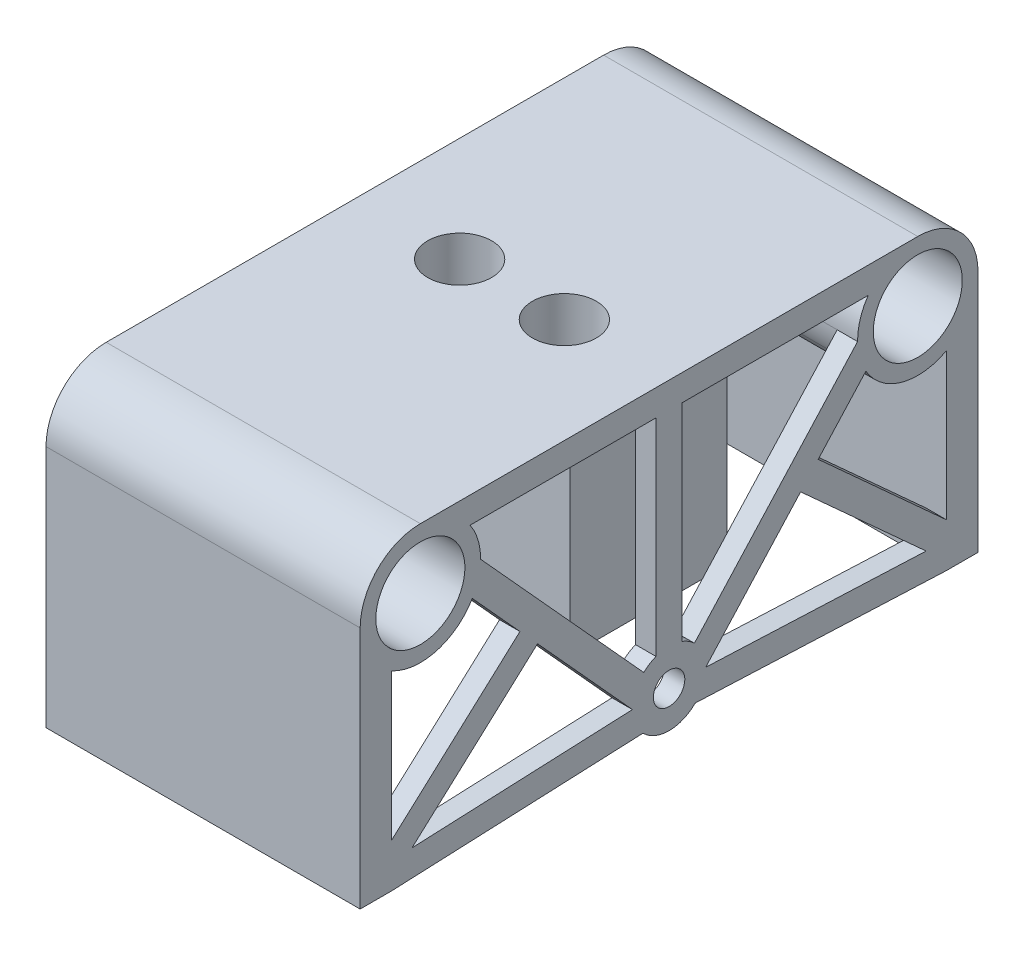
from build123d import *

# Parameters (mm, degrees)
SKETCH4_W           = 60
SKETCH4_H           = 58
BOSS_EXTRUDE2_DEPTH = 59
SKETCH6_R           = 8.500009
SKETCH6_R_2         = 3
SKETCH6_R_3         = 8.5
CUT_EXTRUDE2_DEPTH  = 90.005618
BOSS_EXTRUDE3_START = -30
BOSS_EXTRUDE3_DEPTH = 26.1
CUT_EXTRUDE7_DEPTH  = 52.2
SKETCH9_R           = 6.1
CUT_EXTRUDE8_DEPTH  = 89.005682


with BuildPart() as part:
    # Sketch4 → Boss-Extrude2 (new, symmetric)
    with BuildSketch(Plane.XY):
        Rectangle(SKETCH4_W, SKETCH4_H)
    extrude(amount=BOSS_EXTRUDE2_DEPTH, both=True)

    # Sketch6 → Cut-Extrude2 (cut, through all)
    with BuildSketch(Plane.ZY.offset(30)):
        with BuildLine():
            ThreePointArc((-38.013169, 24), (-36.495651, 20.839801), (-36.000743, 17.369241))
            Line((-36.000743, 17.369241), (-4.839233, -16.942149))
            ThreePointArc((-4.839233, -16.942149), (-3.743539, -16.08511), (-2.500009, -15.461657))
            Line((-2.500009, -15.461657), (-2.500009, 24))
            Line((-2.500009, 24), (-38.013169, 24))
        make_face()
        with BuildLine():
            Line((-28.479809, 1.651024), (-37.584065, 11.67556))
            ThreePointArc((-37.584065, 11.67556), (-44.426868, 6.418217), (-53.000009, 7.40049))
            Line((-53.000009, 7.40049), (-53.000009, -20.618154))
            Line((-53.000009, -20.618154), (-28.479809, 1.651024))
        make_face()
        Polygon((-7.000009, -22.000005), (-25.118256, -2.050322), (-49.094983, -23.825919), align=None)
        with BuildLine():
            ThreePointArc((4.9821, -26.917179), (-9e-06, -29.000005), (-4.982118, -26.917179))
            Line((-4.982118, -26.917179), (-53.000009, -29.000005))
            Line((-53.000009, -29.000005), (-53.000009, -39.703251))
            Line((-53.000009, -39.703251), (52.999991, -37.936887))
            Line((52.999991, -37.936887), (52.999991, -29.000005))
            Line((52.999991, -29.000005), (4.9821, -26.917179))
        make_face()
        with BuildLine():
            ThreePointArc((37.027265, 22.251018), (37.481967, 23.147065), (38.013151, 24))
            Line((38.013151, 24), (2.499991, 24))
            Line((2.499991, 24), (2.499991, -15.461657))
            ThreePointArc((2.499991, -15.461657), (3.743521, -16.08511), (4.839215, -16.942149))
            Line((4.839215, -16.942149), (36.000725, 17.369241))
            ThreePointArc((36.000725, 17.369241), (36.246101, 19.866462), (37.027265, 22.251018))
        make_face()
        Polygon((6.999991, -22.000005), (49.094964, -23.825919), (25.118238, -2.050322), align=None)
        with BuildLine():
            Line((37.584046, 11.67556), (28.479791, 1.651024))
            Line((28.479791, 1.651024), (52.999991, -20.618154))
            Line((52.999991, -20.618154), (52.999991, 7.40049))
            ThreePointArc((52.999991, 7.40049), (52.30182, 7.050477), (51.581504, 6.748658))
            ThreePointArc((51.581504, 6.748658), (43.681779, 6.652356), (37.584046, 11.67556))
        make_face()
        with BuildLine():
            ThreePointArc((-59.000009, 17.5), (-55.631734, 25.631734), (-47.5, 29.000009))
            Line((-47.5, 29.000009), (-47.5, 35.726664))
            Line((-47.5, 35.726664), (-66.854255, 35.726664))
            Line((-66.854255, 35.726664), (-66.147279, 17.5))
            Line((-66.147279, 17.5), (-59.000009, 17.5))
        make_face()
        with BuildLine():
            Line((47.076133, 34.936715), (47.499986, 29))
            ThreePointArc((47.499986, 29), (55.631716, 25.631727), (58.999989, 17.499996))
            Line((58.999989, 17.499996), (67.171398, 17.499996))
            Line((67.171398, 17.499996), (67.171398, 34.57466))
            Line((67.171398, 34.57466), (47.076133, 34.936715))
        make_face()
        with Locations((-47.5, 17.5)):
            Circle(SKETCH6_R)
        with Locations((-9e-06, -22.000005)):
            Circle(SKETCH6_R_2)
        with Locations((47.499991, 17.499994)):
            Circle(SKETCH6_R_3)
    extrude(amount=-CUT_EXTRUDE2_DEPTH, mode=Mode.SUBTRACT)

    # Sketch7 → Boss-Extrude3 (add, symmetric)
    with BuildSketch(Plane.ZY.offset(30).offset(BOSS_EXTRUDE3_START)):
        Polygon((-15, 24), (-15, -11), (15.389045, -11), (15, 24), align=None)
    extrude(amount=BOSS_EXTRUDE3_DEPTH, both=True)

    # Sketch8 → Cut-Extrude7 (cut)
    with BuildSketch(Plane.ZY.offset(26.1)):
        with BuildLine():
            Line((-15, 24), (-38.013169, 24))
            ThreePointArc((-38.013169, 24), (-38.964218, 9.793476), (-53.000009, 7.40049))
            Line((-53.000009, 7.40049), (-53.000009, -24.011121))
            Line((-53.000009, -24.011121), (-53.000009, -39.458207))
            Line((-53.000009, -39.458207), (52.999999, -37.612059))
            Line((52.999999, -37.612059), (52.999999, -24.011121))
            Line((52.999999, -24.011121), (52.999999, 7.40049))
            ThreePointArc((52.999999, 7.40049), (38.964206, 9.793474), (38.013158, 24))
            Line((38.013158, 24), (14.99999, 24))
            Line((14.99999, 24), (14.99999, -11))
            Line((14.99999, -11), (-14.201079, -11))
            Line((-14.201079, -11), (-15, -11))
            Line((-15, -11), (-15, 24))
        make_face()
    extrude(amount=-CUT_EXTRUDE7_DEPTH, mode=Mode.SUBTRACT)

    # Sketch9 → Cut-Extrude8 (cut, through all)
    with BuildSketch(Plane(origin=(0, 29, 0), x_dir=(1, 0, 0), z_dir=(0, 1, 0))):
        with Locations(Location((-10, 2e-06, 0), (0, 0, 270))):
            Circle(SKETCH9_R)
        with Locations(Location((10, 2e-06, 0), (0, 0, 90))):
            Circle(SKETCH9_R)
    extrude(amount=-CUT_EXTRUDE8_DEPTH, mode=Mode.SUBTRACT)


solid = part.part
